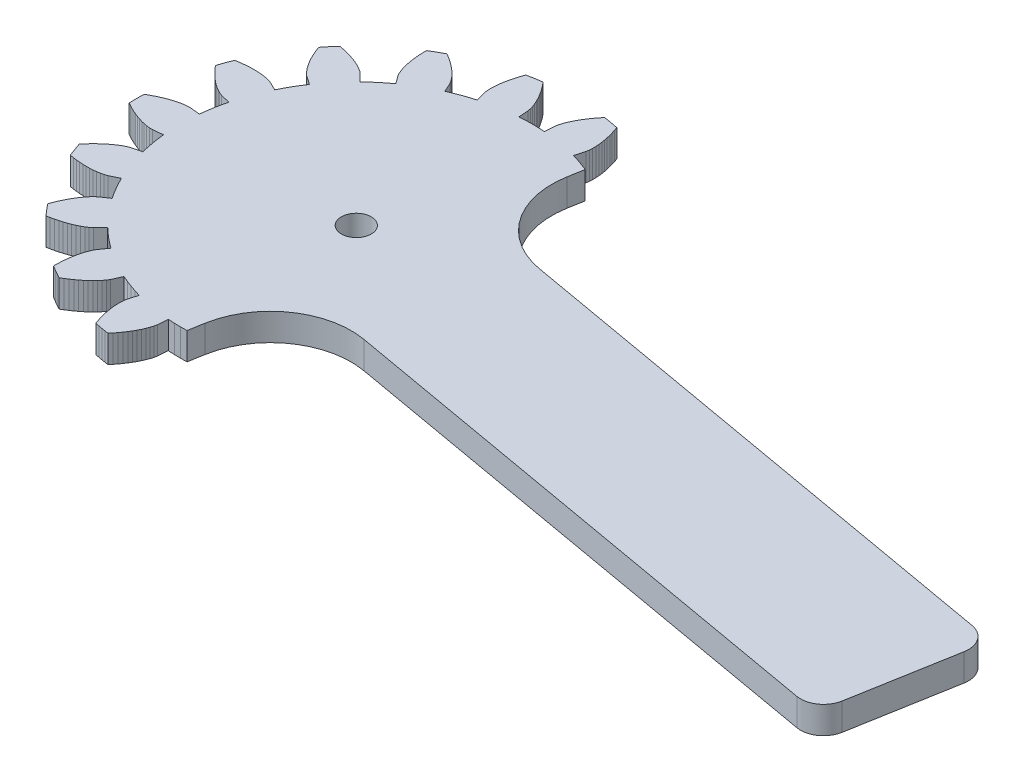
from build123d import *

# Parameters (mm, degrees)
SKETCH1_R           = 3.3
BOSS_EXTRUDE1_DEPTH = 6


with BuildPart() as part:
    # Sketch1 → Boss-Extrude1 (new body)
    with BuildSketch(Plane(origin=(0, 0, 0), x_dir=(1, 0, 0), z_dir=(0, 1, 0))):
        with BuildLine():
            Line((28.40365058, 11.949698378), (144.47989106, -8.517677435))
            ThreePointArc((144.47989106, -8.517677435), (147.759050654, -10.6067326), (148.600581565, -14.402633659))
            Line((148.600581565, -14.402633659), (144.564859027, -37.290350392))
            ThreePointArc((144.564859027, -37.290350392), (142.475803862, -40.569509985), (138.679902803, -41.411040897))
            Line((138.679902803, -41.411040897), (22.603662322, -20.943665084))
            ThreePointArc((22.603662322, -20.943665084), (9.318008616, -23.889023275), (2.006315538, -35.366081853))
            Line((2.006315538, -35.366081853), (1.4038295, -38.7829495))
            Line((1.4038295, -38.7829495), (-5e-07, -38.8083495))
            Line((-5e-07, -38.8083495), (-1.4038295, -38.7829495))
            Line((-1.4038295, -38.7829495), (-2.8057975, -38.7067775))
            Line((-2.8057975, -38.7067775), (-2.9661555, -40.9190335))
            Line((-2.9661555, -40.9190335), (-3.0984895, -41.5915125))
            Line((-3.0984895, -41.5915125), (-3.3017465, -42.2583465))
            Line((-3.3017465, -42.2583465), (-3.5532345, -42.9206655))
            Line((-3.5532345, -42.9206655), (-3.8452775, -43.5785545))
            Line((-3.8452775, -43.5785545), (-4.1735585, -44.2317575))
            Line((-4.1735585, -44.2317575), (-4.5353395, -44.8800215))
            Line((-4.5353395, -44.8800215), (-4.9285875, -45.5229525))
            Line((-4.9285875, -45.5229525), (-5.3518645, -46.1601255))
            Line((-5.3518645, -46.1601255), (-5.8039285, -46.7911175))
            Line((-5.8039285, -46.7911175), (-6.2838755, -47.4154785))
            Line((-6.2838755, -47.4154785), (-6.7908875, -48.0327545))
            Line((-6.7908875, -48.0327545), (-7.6084295, -47.9100445))
            Line((-7.6084295, -47.9100445), (-8.4237405, -47.7734485))
            Line((-8.4237405, -47.7734485), (-9.2366255, -47.6229675))
            Line((-9.2366255, -47.6229675), (-10.0468005, -47.4586585))
            Line((-10.0468005, -47.4586585), (-10.3121175, -46.7051815))
            Line((-10.3121175, -46.7051815), (-10.5495795, -45.9543295))
            Line((-10.5495795, -45.9543295), (-10.7585935, -45.2067505))
            Line((-10.7585935, -45.2067505), (-10.9383975, -44.4632645))
            Line((-10.9383975, -44.4632645), (-11.0880595, -43.7246045))
            Line((-11.0880595, -43.7246045), (-11.2062825, -42.9917015))
            Line((-11.2062825, -42.9917015), (-11.2913725, -42.2655995))
            Line((-11.2913725, -42.2655995), (-11.3407895, -41.5475135))
            Line((-11.3407895, -41.5475135), (-11.3505825, -40.8391075))
            Line((-11.3505825, -40.8391075), (-11.3134985, -40.1429785))
            Line((-11.3134985, -40.1429785), (-11.2078635, -39.4658145))
            Line((-11.2078635, -39.4658145), (-10.6019035, -37.3321295))
            Line((-10.6019035, -37.3321295), (-11.9453945, -36.9241775))
            Line((-11.9453945, -36.9241775), (-13.2732215, -36.4679085))
            Line((-13.2732215, -36.4679085), (-14.5837205, -35.9639165))
            Line((-14.5837205, -35.9639165), (-15.8750845, -35.4128495))
            Line((-15.8750845, -35.4128495), (-16.7824295, -37.4368345))
            Line((-16.7824295, -37.4368345), (-17.1367595, -38.0234895))
            Line((-17.1367595, -38.0234895), (-17.5558315, -38.5805965))
            Line((-17.5558315, -38.5805965), (-18.0186755, -39.1169595))
            Line((-18.0186755, -39.1169595), (-18.5181245, -39.6352885))
            Line((-18.5181245, -39.6352885), (-19.0500285, -40.1368255))
            Line((-19.0500285, -40.1368255), (-19.6116785, -40.6222485))
            Line((-19.6116785, -40.6222485), (-20.2011285, -41.0918945))
            Line((-20.2011285, -41.0918945), (-20.8167955, -41.5458765))
            Line((-20.8167955, -41.5458765), (-21.4574125, -41.9841965))
            Line((-21.4574125, -41.9841965), (-22.1219605, -42.4067675))
            Line((-22.1219605, -42.4067675), (-22.8095385, -42.8133935))
            Line((-22.8095385, -42.8133935), (-23.5357815, -42.4184795))
            Line((-23.5357815, -42.4184795), (-24.2552225, -42.0112615))
            Line((-24.2552225, -42.0112615), (-24.9676075, -41.5918225))
            Line((-24.9676075, -41.5918225), (-25.6727395, -41.1603335))
            Line((-25.6727395, -41.1603335), (-25.6643575, -40.3615595))
            Line((-25.6643575, -40.3615595), (-25.6306605, -39.5747805))
            Line((-25.6306605, -39.5747805), (-25.5713935, -38.8008145))
            Line((-25.5713935, -38.8008145), (-25.4860495, -38.0406205))
            Line((-25.4860495, -38.0406205), (-25.3740635, -37.2953565))
            Line((-25.3740635, -37.2953565), (-25.2345055, -36.5662065))
            Line((-25.2345055, -36.5662065), (-25.0661035, -35.8547815))
            Line((-25.0661035, -35.8547815), (-24.8669385, -35.1631105))
            Line((-24.8669385, -35.1631105), (-24.6338515, -34.4940745))
            Line((-24.6338515, -34.4940745), (-24.3609425, -33.8526115))
            Line((-24.3609425, -33.8526115), (-24.0300375, -33.2524095))
            Line((-24.0300375, -33.2524095), (-22.7308835, -31.4546545))
            Line((-22.7308835, -31.4546545), (-23.8538175, -30.6118255))
            Line((-23.8538175, -30.6118255), (-24.9455095, -29.7289215))
            Line((-24.9455095, -29.7289215), (-26.0045765, -28.8070995))
            Line((-26.0045765, -28.8070995), (-27.0296075, -27.8475725))
            Line((-27.0296075, -27.8475725), (-28.5744635, -29.4391925))
            Line((-28.5744635, -29.4391925), (-29.1080895, -29.8692715))
            Line((-29.1080895, -29.8692715), (-29.6924305, -30.2494525))
            Line((-29.6924305, -30.2494525), (-30.3108075, -30.5951745))
            Line((-30.3108075, -30.5951745), (-30.9574075, -30.9114045))
            Line((-30.9574075, -30.9114045), (-31.6287575, -31.2007955))
            Line((-31.6287575, -31.2007955), (-32.3225725, -31.4648425))
            Line((-32.3225725, -31.4648425), (-33.0371025, -31.7045625))
            Line((-33.0371025, -31.7045625), (-33.7709085, -31.9206035))
            Line((-33.7709085, -31.9206035), (-34.5228335, -32.1133615))
            Line((-34.5228335, -32.1133615), (-35.2918325, -32.2831455))
            Line((-35.2918325, -32.2831455), (-36.0770035, -32.4301275))
            Line((-36.0770035, -32.4301275), (-36.6243735, -31.8106215))
            Line((-36.6243735, -31.8106215), (-37.1611315, -31.1819145))
            Line((-37.1611315, -31.1819145), (-37.6871095, -30.5441205))
            Line((-37.6871095, -30.5441205), (-38.2021365, -29.8974655))
            Line((-38.2021365, -29.8974655), (-37.9210715, -29.1497455))
            Line((-37.9210715, -29.1497455), (-37.6203355, -28.4219225))
            Line((-37.6203355, -28.4219225), (-37.2999005, -27.7148995))
            Line((-37.2999005, -27.7148995), (-36.9597375, -27.0297485))
            Line((-36.9597375, -27.0297485), (-36.5995655, -26.3677115))
            Line((-36.5995655, -26.3677115), (-36.2190455, -25.7302845))
            Line((-36.2190455, -25.7302845), (-35.8174995, -25.1193865))
            Line((-35.8174995, -25.1193865), (-35.3937715, -24.5375285))
            Line((-35.3937715, -24.5375285), (-34.9459415, -23.9885505))
            Line((-34.9459415, -23.9885505), (-34.4700575, -23.4791105))
            Line((-34.4700575, -23.4791105), (-33.9538455, -23.0282895))
            Line((-33.9538455, -23.0282895), (-32.1181595, -21.7832935))
            Line((-32.1181595, -21.7832935), (-32.8850975, -20.6072175))
            Line((-32.8850975, -20.6072175), (-33.6089975, -19.4041605))
            Line((-33.6089975, -19.4041605), (-34.2889275, -18.1757315))
            Line((-34.2889275, -18.1757315), (-34.9239555, -16.9234835))
            Line((-34.9239555, -16.9234835), (-36.9200005, -17.8907435))
            Line((-36.9200005, -17.8907435), (-37.5685475, -18.1124015))
            Line((-37.5685475, -18.1124015), (-38.2476585, -18.2697685))
            Line((-38.2476585, -18.2697685), (-38.9470055, -18.3831375))
            Line((-38.9470055, -18.3831375), (-39.6627495, -18.4591675))
            Line((-39.6627495, -18.4591675), (-40.3926045, -18.5014725))
            Line((-40.3926045, -18.5014725), (-41.1349055, -18.5123105))
            Line((-41.1349055, -18.5123105), (-41.8883255, -18.4931755))
            Line((-41.8883255, -18.4931755), (-42.6517645, -18.4452255))
            Line((-42.6517645, -18.4452255), (-43.4242635, -18.3691955))
            Line((-43.4242635, -18.3691955), (-44.2049465, -18.2657325))
            Line((-44.2049465, -18.2657325), (-44.9930235, -18.1352895))
            Line((-44.9930235, -18.1352895), (-45.2955375, -17.3659235))
            Line((-45.2955375, -17.3659235), (-45.5849005, -16.5915335))
            Line((-45.5849005, -16.5915335), (-45.8609985, -15.8123465))
            Line((-45.8609985, -15.8123465), (-46.1238035, -15.0285305))
            Line((-46.1238035, -15.0285305), (-45.6039505, -14.4220355))
            Line((-45.6039505, -14.4220355), (-45.0724135, -13.8409675))
            Line((-45.0724135, -13.8409675), (-44.5295025, -13.2861755))
            Line((-44.5295025, -13.2861755), (-43.9754995, -12.7587025))
            Line((-43.9754995, -12.7587025), (-43.4106325, -12.2597615))
            Line((-43.4106325, -12.2597615), (-42.8350685, -11.7909335))
            Line((-42.8350685, -11.7909335), (-42.2487795, -11.3541955))
            Line((-42.2487795, -11.3541955), (-41.6515975, -10.9523385))
            Line((-41.6515975, -10.9523385), (-41.0430135, -10.5896555))
            Line((-41.0430135, -10.5896555), (-40.4215885, -10.2737075))
            Line((-40.4215885, -10.2737075), (-39.7823265, -10.0266215))
            Line((-39.7823265, -10.0266215), (-37.6315115, -9.4845295))
            Line((-37.6315115, -9.4845295), (-37.9499705, -8.1170775))
            Line((-37.9499705, -8.1170775), (-38.2187595, -6.7389865))
            Line((-38.2187595, -6.7389865), (-38.4375095, -5.3520905))
            Line((-38.4375095, -5.3520905), (-38.6059685, -3.9581945))
            Line((-38.6059685, -3.9581945), (-40.8124665, -4.1844245))
            Line((-40.8124665, -4.1844245), (-41.4977015, -4.1708775))
            Line((-41.4977015, -4.1708775), (-42.1896825, -4.0864935))
            Line((-42.1896825, -4.0864935), (-42.8856145, -3.9538485))
            Line((-42.8856145, -3.9538485), (-43.5842275, -3.7804795))
            Line((-43.5842275, -3.7804795), (-44.2845055, -3.5706195))
            Line((-44.2845055, -3.5706195), (-44.9857425, -3.3269205))
            Line((-44.9857425, -3.3269205), (-45.6871775, -3.0512735))
            Line((-45.6871775, -3.0512735), (-46.3881895, -2.7450625))
            Line((-46.3881895, -2.7450625), (-47.0881005, -2.4094155))
            Line((-47.0881005, -2.4094155), (-47.7863185, -2.0451795))
            Line((-47.7863185, -2.0451795), (-48.4822505, -1.6530605))
            Line((-48.4822505, -1.6530605), (-48.5033885, -0.8266575))
            Line((-48.5033885, -0.8266575), (-48.5104155, 5e-07))
            Line((-48.5104155, 5e-07), (-48.5033885, 0.8266575))
            Line((-48.5033885, 0.8266575), (-48.4822505, 1.6530605))
            Line((-48.4822505, 1.6530605), (-47.7863185, 2.0451795))
            Line((-47.7863185, 2.0451795), (-47.0881005, 2.4094155))
            Line((-47.0881005, 2.4094155), (-46.3881895, 2.7450625))
            Line((-46.3881895, 2.7450625), (-45.6871775, 3.0512735))
            Line((-45.6871775, 3.0512735), (-44.9857425, 3.3269205))
            Line((-44.9857425, 3.3269205), (-44.2845055, 3.5706195))
            Line((-44.2845055, 3.5706195), (-43.5842275, 3.7804795))
            Line((-43.5842275, 3.7804795), (-42.8856145, 3.9538485))
            Line((-42.8856145, 3.9538485), (-42.1896825, 4.0864935))
            Line((-42.1896825, 4.0864935), (-41.4977015, 4.1708775))
            Line((-41.4977015, 4.1708775), (-40.8124665, 4.1844245))
            Line((-40.8124665, 4.1844245), (-38.6059685, 3.9581945))
            Line((-38.6059685, 3.9581945), (-38.4375095, 5.3520905))
            Line((-38.4375095, 5.3520905), (-38.2187595, 6.7389865))
            Line((-38.2187595, 6.7389865), (-37.9499705, 8.1170785))
            Line((-37.9499705, 8.1170785), (-37.6315115, 9.4845295))
            Line((-37.6315115, 9.4845295), (-39.7823265, 10.0266215))
            Line((-39.7823265, 10.0266215), (-40.4215885, 10.2737075))
            Line((-40.4215885, 10.2737075), (-41.0430135, 10.5896555))
            Line((-41.0430135, 10.5896555), (-41.6515975, 10.9523385))
            Line((-41.6515975, 10.9523385), (-42.2487795, 11.3541955))
            Line((-42.2487795, 11.3541955), (-42.8350685, 11.7909345))
            Line((-42.8350685, 11.7909345), (-43.4106325, 12.2597615))
            Line((-43.4106325, 12.2597615), (-43.9754995, 12.7587025))
            Line((-43.9754995, 12.7587025), (-44.5295025, 13.2861755))
            Line((-44.5295025, 13.2861755), (-45.0724135, 13.8409685))
            Line((-45.0724135, 13.8409685), (-45.6039505, 14.4220355))
            Line((-45.6039505, 14.4220355), (-46.1238035, 15.0285305))
            Line((-46.1238035, 15.0285305), (-45.8609985, 15.8123465))
            Line((-45.8609985, 15.8123465), (-45.5849005, 16.5915345))
            Line((-45.5849005, 16.5915345), (-45.2955375, 17.3659235))
            Line((-45.2955375, 17.3659235), (-44.9930235, 18.1352895))
            Line((-44.9930235, 18.1352895), (-44.2049465, 18.2657325))
            Line((-44.2049465, 18.2657325), (-43.4242635, 18.3691955))
            Line((-43.4242635, 18.3691955), (-42.6517645, 18.4452265))
            Line((-42.6517645, 18.4452265), (-41.8883255, 18.4931755))
            Line((-41.8883255, 18.4931755), (-41.1349055, 18.5123105))
            Line((-41.1349055, 18.5123105), (-40.3926045, 18.5014725))
            Line((-40.3926045, 18.5014725), (-39.6627495, 18.4591675))
            Line((-39.6627495, 18.4591675), (-38.9470055, 18.3831375))
            Line((-38.9470055, 18.3831375), (-38.2476585, 18.2697685))
            Line((-38.2476585, 18.2697685), (-37.5685475, 18.1124015))
            Line((-37.5685475, 18.1124015), (-36.9200005, 17.8907445))
            Line((-36.9200005, 17.8907445), (-34.9239555, 16.9234835))
            Line((-34.9239555, 16.9234835), (-34.2889275, 18.1757325))
            Line((-34.2889275, 18.1757325), (-33.6089975, 19.4041605))
            Line((-33.6089975, 19.4041605), (-32.8850975, 20.6072175))
            Line((-32.8850975, 20.6072175), (-32.1181595, 21.7832945))
            Line((-32.1181595, 21.7832945), (-33.9538455, 23.0282895))
            Line((-33.9538455, 23.0282895), (-34.4700575, 23.4791105))
            Line((-34.4700575, 23.4791105), (-34.9459415, 23.9885505))
            Line((-34.9459415, 23.9885505), (-35.3937715, 24.5375285))
            Line((-35.3937715, 24.5375285), (-35.8174995, 25.1193865))
            Line((-35.8174995, 25.1193865), (-36.2190455, 25.7302845))
            Line((-36.2190455, 25.7302845), (-36.5995655, 26.3677115))
            Line((-36.5995655, 26.3677115), (-36.9597375, 27.0297485))
            Line((-36.9597375, 27.0297485), (-37.2999005, 27.7148995))
            Line((-37.2999005, 27.7148995), (-37.6203355, 28.4219225))
            Line((-37.6203355, 28.4219225), (-37.9210715, 29.1497455))
            Line((-37.9210715, 29.1497455), (-38.2021365, 29.8974655))
            Line((-38.2021365, 29.8974655), (-37.6871095, 30.5441205))
            Line((-37.6871095, 30.5441205), (-37.1611315, 31.1819145))
            Line((-37.1611315, 31.1819145), (-36.6243735, 31.8106215))
            Line((-36.6243735, 31.8106215), (-36.0770035, 32.4301275))
            Line((-36.0770035, 32.4301275), (-35.2918325, 32.2831465))
            Line((-35.2918325, 32.2831465), (-34.5228335, 32.1133615))
            Line((-34.5228335, 32.1133615), (-33.7709085, 31.9206035))
            Line((-33.7709085, 31.9206035), (-33.0371025, 31.7045625))
            Line((-33.0371025, 31.7045625), (-32.3225725, 31.4648425))
            Line((-32.3225725, 31.4648425), (-31.6287575, 31.2007955))
            Line((-31.6287575, 31.2007955), (-30.9574075, 30.9114045))
            Line((-30.9574075, 30.9114045), (-30.3108075, 30.5951745))
            Line((-30.3108075, 30.5951745), (-29.6924305, 30.2494525))
            Line((-29.6924305, 30.2494525), (-29.1080895, 29.8692715))
            Line((-29.1080895, 29.8692715), (-28.5744635, 29.4391925))
            Line((-28.5744635, 29.4391925), (-27.0296075, 27.8475725))
            Line((-27.0296075, 27.8475725), (-26.0045765, 28.8070995))
            Line((-26.0045765, 28.8070995), (-24.9455095, 29.7289225))
            Line((-24.9455095, 29.7289225), (-23.8538175, 30.6118265))
            Line((-23.8538175, 30.6118265), (-22.7308835, 31.4546545))
            Line((-22.7308835, 31.4546545), (-24.0300375, 33.2524105))
            Line((-24.0300375, 33.2524105), (-24.3609425, 33.8526125))
            Line((-24.3609425, 33.8526125), (-24.6338515, 34.4940745))
            Line((-24.6338515, 34.4940745), (-24.8669385, 35.1631105))
            Line((-24.8669385, 35.1631105), (-25.0661035, 35.8547815))
            Line((-25.0661035, 35.8547815), (-25.2345055, 36.5662065))
            Line((-25.2345055, 36.5662065), (-25.3740635, 37.2953565))
            Line((-25.3740635, 37.2953565), (-25.4860495, 38.0406205))
            Line((-25.4860495, 38.0406205), (-25.5713935, 38.8008145))
            Line((-25.5713935, 38.8008145), (-25.6306605, 39.5747805))
            Line((-25.6306605, 39.5747805), (-25.6643575, 40.3615595))
            Line((-25.6643575, 40.3615595), (-25.6727395, 41.1603335))
            Line((-25.6727395, 41.1603335), (-24.9676075, 41.5918225))
            Line((-24.9676075, 41.5918225), (-24.2552225, 42.0112615))
            Line((-24.2552225, 42.0112615), (-23.5357815, 42.4184795))
            Line((-23.5357815, 42.4184795), (-22.8095385, 42.8133935))
            Line((-22.8095385, 42.8133935), (-22.1219605, 42.4067675))
            Line((-22.1219605, 42.4067675), (-21.4574125, 41.9841965))
            Line((-21.4574125, 41.9841965), (-20.8167955, 41.5458765))
            Line((-20.8167955, 41.5458765), (-20.2011285, 41.0918945))
            Line((-20.2011285, 41.0918945), (-19.6116785, 40.6222485))
            Line((-19.6116785, 40.6222485), (-19.0500285, 40.1368265))
            Line((-19.0500285, 40.1368265), (-18.5181245, 39.6352885))
            Line((-18.5181245, 39.6352885), (-18.0186755, 39.1169595))
            Line((-18.0186755, 39.1169595), (-17.5558315, 38.5805965))
            Line((-17.5558315, 38.5805965), (-17.1367595, 38.0234895))
            Line((-17.1367595, 38.0234895), (-16.7824295, 37.4368345))
            Line((-16.7824295, 37.4368345), (-15.8750845, 35.4128495))
            Line((-15.8750845, 35.4128495), (-14.5837205, 35.9639165))
            Line((-14.5837205, 35.9639165), (-13.2732215, 36.4679085))
            Line((-13.2732215, 36.4679085), (-11.9453945, 36.9241775))
            Line((-11.9453945, 36.9241775), (-10.6019035, 37.3321295))
            Line((-10.6019035, 37.3321295), (-11.2078635, 39.4658145))
            Line((-11.2078635, 39.4658145), (-11.3134985, 40.1429785))
            Line((-11.3134985, 40.1429785), (-11.3505825, 40.8391075))
            Line((-11.3505825, 40.8391075), (-11.3407895, 41.5475135))
            Line((-11.3407895, 41.5475135), (-11.2913725, 42.2656005))
            Line((-11.2913725, 42.2656005), (-11.2062825, 42.9917015))
            Line((-11.2062825, 42.9917015), (-11.0880595, 43.7246045))
            Line((-11.0880595, 43.7246045), (-10.9383975, 44.4632645))
            Line((-10.9383975, 44.4632645), (-10.7585935, 45.2067505))
            Line((-10.7585935, 45.2067505), (-10.5495795, 45.9543295))
            Line((-10.5495795, 45.9543295), (-10.3121175, 46.7051815))
            Line((-10.3121175, 46.7051815), (-10.0468005, 47.4586585))
            Line((-10.0468005, 47.4586585), (-9.2366255, 47.6229685))
            Line((-9.2366255, 47.6229685), (-8.4237405, 47.7734485))
            Line((-8.4237405, 47.7734485), (-7.6084295, 47.9100445))
            Line((-7.6084295, 47.9100445), (-6.7908875, 48.0327545))
            Line((-6.7908875, 48.0327545), (-6.2838755, 47.4154785))
            Line((-6.2838755, 47.4154785), (-5.8039285, 46.7911185))
            Line((-5.8039285, 46.7911185), (-5.3518645, 46.1601255))
            Line((-5.3518645, 46.1601255), (-4.9285875, 45.5229525))
            Line((-4.9285875, 45.5229525), (-4.5353395, 44.8800225))
            Line((-4.5353395, 44.8800225), (-4.1735585, 44.2317575))
            Line((-4.1735585, 44.2317575), (-3.8452775, 43.5785545))
            Line((-3.8452775, 43.5785545), (-3.5532345, 42.9206665))
            Line((-3.5532345, 42.9206665), (-3.3017465, 42.2583465))
            Line((-3.3017465, 42.2583465), (-3.0984895, 41.5915125))
            Line((-3.0984895, 41.5915125), (-2.9661555, 40.9190335))
            Line((-2.9661555, 40.9190335), (-2.8057975, 38.7067775))
            Line((-2.8057975, 38.7067775), (-1.4038295, 38.7829495))
            Line((-1.4038295, 38.7829495), (-5e-07, 38.8083495))
            Line((-5e-07, 38.8083495), (1.4038295, 38.7829495))
            Line((1.4038295, 38.7829495), (2.8057965, 38.7067775))
            Line((2.8057965, 38.7067775), (2.9661555, 40.9190335))
            Line((2.9661555, 40.9190335), (3.0984895, 41.5915125))
            Line((3.0984895, 41.5915125), (3.3017455, 42.2583465))
            Line((3.3017455, 42.2583465), (3.5532345, 42.9206665))
            Line((3.5532345, 42.9206665), (3.8452775, 43.5785545))
            Line((3.8452775, 43.5785545), (4.1735585, 44.2317575))
            Line((4.1735585, 44.2317575), (4.5353395, 44.8800225))
            Line((4.5353395, 44.8800225), (4.9285875, 45.5229525))
            Line((4.9285875, 45.5229525), (5.3518645, 46.1601255))
            Line((5.3518645, 46.1601255), (5.8039285, 46.7911185))
            Line((5.8039285, 46.7911185), (6.2838755, 47.4154785))
            Line((6.2838755, 47.4154785), (6.7908875, 48.0327545))
            Line((6.7908875, 48.0327545), (7.6084285, 47.9100445))
            Line((7.6084285, 47.9100445), (8.4237405, 47.7734485))
            Line((8.4237405, 47.7734485), (9.2366255, 47.6229685))
            Line((9.2366255, 47.6229685), (10.0468005, 47.4586585))
            Line((10.0468005, 47.4586585), (10.3121175, 46.7051815))
            Line((10.3121175, 46.7051815), (10.5495795, 45.9543295))
            Line((10.5495795, 45.9543295), (10.7585935, 45.2067505))
            Line((10.7585935, 45.2067505), (10.9383965, 44.4632645))
            Line((10.9383965, 44.4632645), (11.0880595, 43.7246045))
            Line((11.0880595, 43.7246045), (11.2062825, 42.9917015))
            Line((11.2062825, 42.9917015), (11.2913725, 42.2656005))
            Line((11.2913725, 42.2656005), (11.3407895, 41.5475135))
            Line((11.3407895, 41.5475135), (11.3505825, 40.8391075))
            Line((11.3505825, 40.8391075), (11.3134985, 40.1429785))
            Line((11.3134985, 40.1429785), (11.2078625, 39.4658145))
            Line((11.2078625, 39.4658145), (10.6019035, 37.3321295))
            Line((10.6019035, 37.3321295), (11.9453945, 36.9241775))
            Line((11.9453945, 36.9241775), (13.2732215, 36.4679085))
            Line((13.2732215, 36.4679085), (14.5837205, 35.9639165))
            Line((14.5837205, 35.9639165), (13.981233811, 32.547045162))
            ThreePointArc((13.981233811, 32.547045162), (16.926592002, 19.261391456), (28.40365058, 11.949698378))
        make_face()
        with Locations(Location((0, 0, 0), (0, 0, 270))):
            Circle(SKETCH1_R, mode=Mode.SUBTRACT)
    extrude(amount=BOSS_EXTRUDE1_DEPTH)


solid = part.part
